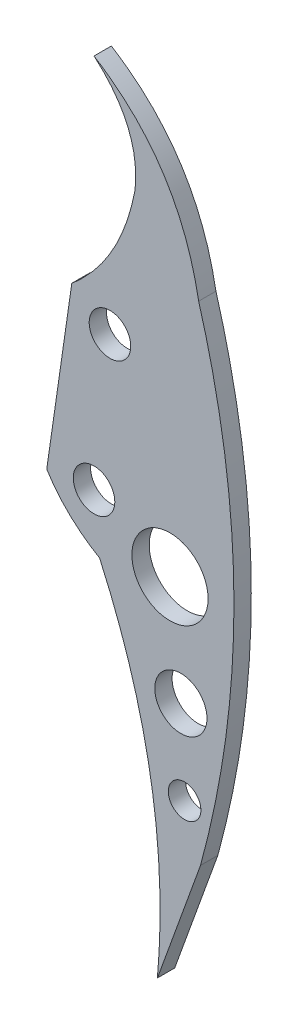
from build123d import *

# Parameters (mm, degrees)
ESQUISSE1_R        = 1.101038198
ESQUISSE1_R_2      = 0.6
ESQUISSE1_R_3      = 0.753706931
ESQUISSE1_R_4      = 0.470708968
BOSS_EXTRU_1_DEPTH = 0.5


with BuildPart() as part:
    # Esquisse1 → Boss.-Extru.1 (new body)
    with BuildSketch(Plane.XY):
        with BuildLine():
            Line((4.327755202, 9.268221518), (3.603132185, 4.253126908))
            add(Edge.make_bspline(
                [(3.603132185, 4.253126908), (3.97023948, 3.660792989), (4.479491264, 3.174109207), (5.130887536, 2.793075563)],
                knots=[0.419081869, 0.419081869, 0.419081869, 0.419081869, 1, 1, 1, 1], degree=3))
            add(Edge.make_bspline(
                [(5.130887536, 2.793075563), (7.24661574, -1.876356548), (6.801291284, -6.882931027)],
                knots=[0, 0, 0, 1, 1, 1], degree=2))
            Line((6.801291284, -6.882931027), (8.047479128, -3.441465514))
            add(Edge.make_bspline(
                [(7.993289874, 10.651808238), (10.006516758, 3.73495856), (8.047479128, -3.441465514)],
                knots=[0, 0, 0, 1, 1, 1], degree=2))
            add(Edge.make_bspline(
                [(7.993289874, 10.651808238), (7.437530526, 13.742255062), (4.969978084, 15.276811926)],
                knots=[0, 0, 0, 1, 1, 1], degree=2))
            add(Edge.make_bspline(
                [(4.969978084, 15.276811926), (6.336855169, 14.093829897), (6.151102735, 12.493995378)],
                knots=[0, 0, 0, 1, 1, 1], degree=2))
            add(Edge.make_bspline(
                [(6.151102735, 12.493995378), (5.8933943, 11.152214383), (5.285611789, 10.07695643), (4.327755202, 9.268221518)],
                knots=[0, 0, 0, 0, 0.717084893, 0.717084893, 0.717084893, 0.717084893], degree=3))
        make_face()
        with Locations((7.16473136, 3.33945502)):
            Circle(ESQUISSE1_R, mode=Mode.SUBTRACT)
        with Locations((5.43038475, 8.539470271)):
            Circle(ESQUISSE1_R_2, mode=Mode.SUBTRACT)
        with Locations((7.47952091, 0.328032682)):
            Circle(ESQUISSE1_R_3, mode=Mode.SUBTRACT)
        with Locations((7.586653272, -2.053387377)):
            Circle(ESQUISSE1_R_4, mode=Mode.SUBTRACT)
        with Locations((4.969978084, 4.416971754)):
            Circle(ESQUISSE1_R_2, mode=Mode.SUBTRACT)
    extrude(amount=BOSS_EXTRU_1_DEPTH)


solid = part.part
